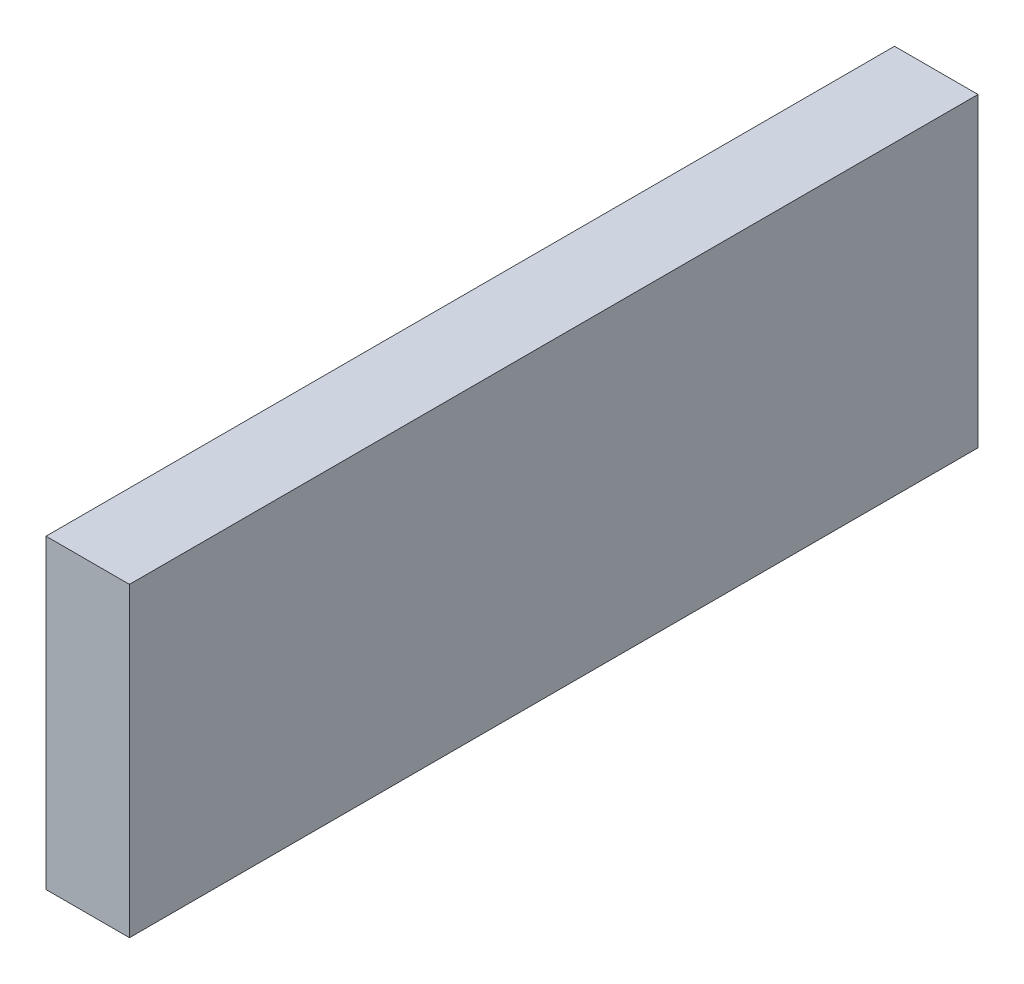
from build123d import *

# Parameters (mm, degrees)
SKETCH1_W           = 38.1
SKETCH1_H           = 139.7
BOSS_EXTRUDE1_DEPTH = 387.35


with BuildPart() as part:
    # Sketch1 → Boss-Extrude1 (new body)
    with BuildSketch(Plane.XY):
        Rectangle(SKETCH1_W, SKETCH1_H)
    extrude(amount=BOSS_EXTRUDE1_DEPTH)


solid = part.part
